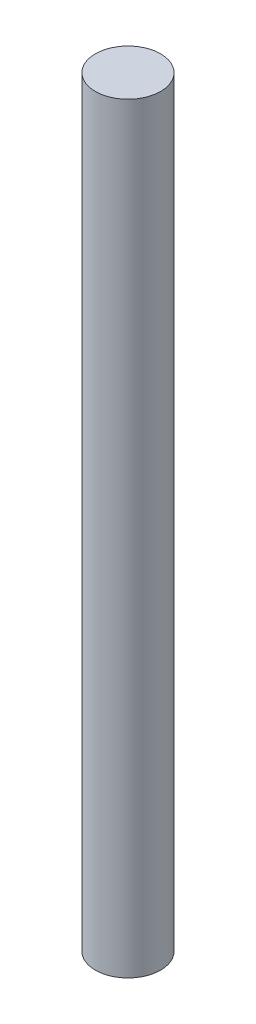
from build123d import *

# Parameters (mm, degrees)
SKETCH1_R           = 1.5
BOSS_EXTRUDE1_DEPTH = 35


with BuildPart() as part:
    # Sketch1 → Boss-Extrude1 (new body)
    with BuildSketch(Plane(origin=(0, 0, 0), x_dir=(1, 0, 0), z_dir=(0, 1, 0))):
        with Locations(Location((0, 0, 0), (0, 0, 270))):
            Circle(SKETCH1_R)
    extrude(amount=BOSS_EXTRUDE1_DEPTH)


solid = part.part
